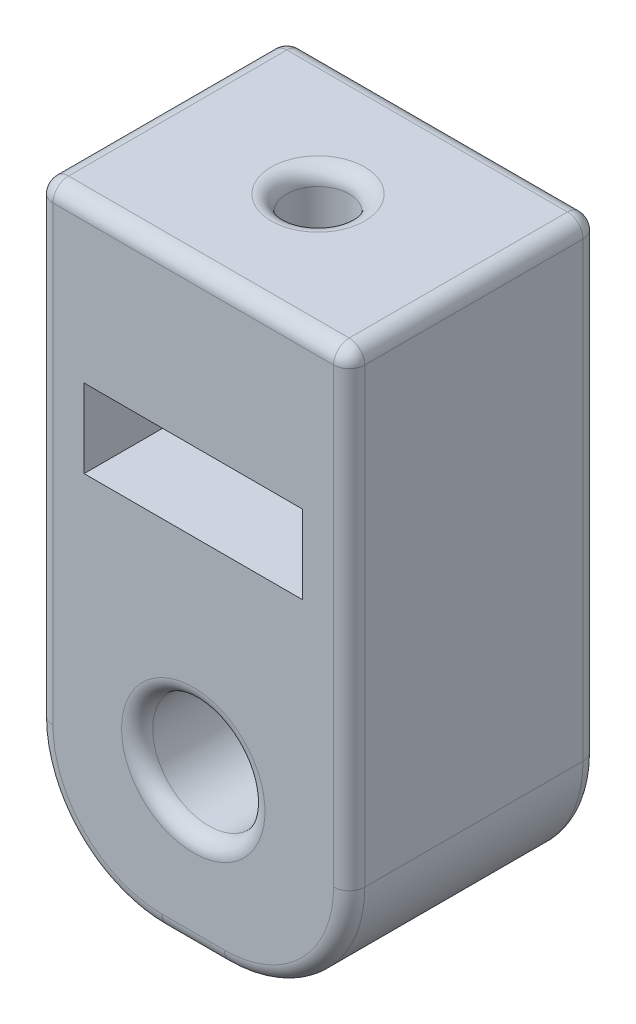
from build123d import *

# Parameters (mm, degrees)
SKETCH1_W           = 12.7
SKETCH1_H           = 24.13
SKETCH1_R           = 2.286
BOSS_EXTRUDE1_DEPTH = 10.16
SKETCH2_R           = 1.27
CUT_EXTRUDE1_DEPTH  = 15.24
FILLET2_R           = 5.08
FILLET1_R           = 0.635
SKETCH3_W           = 8.89
SKETCH3_H           = 3.19532
CUT_EXTRUDE2_DEPTH  = 30.099355663


with BuildPart() as part:
    # Sketch1 → Boss-Extrude1 (new body)
    with BuildSketch(Plane.XY):
        with Locations((6.35, 12.065)):
            Rectangle(SKETCH1_W, SKETCH1_H)
        with Locations((6.35, 6.35)):
            Circle(SKETCH1_R, mode=Mode.SUBTRACT)
    extrude(amount=BOSS_EXTRUDE1_DEPTH)

    # Sketch2 → Cut-Extrude1 (cut)
    with BuildSketch(Plane(origin=(0, 24.13, 0), x_dir=(1, 0, 0), z_dir=(0, 1, 0))):
        with Locations(Location((6.35, -5.08, 0), (0, 0, 270))):
            Circle(SKETCH2_R)
    extrude(amount=-CUT_EXTRUDE1_DEPTH, mode=Mode.SUBTRACT)

    # Fillet2
    fillet2_edges = [part.edges().sort_by_distance(p)[0] for p in [
        (12.7, 0, 5.08),
        (0, 0, 5.08),
    ]]
    fillet(fillet2_edges, radius=FILLET2_R)

    # Fillet1
    fillet1_edges = [part.edges().sort_by_distance(p)[0] for p in [
        (4.064, 6.35, 0),
        (4.064, 6.35, 10.16),
        (6.35, 24.13, 10.16),
        (6.35, 24.13, 3.81),
        (12.7, 14.605, 0),
        (12.7, 14.605, 10.16),
        (6.35, 0, 0),
        (1.487897552, 1.487897552, 0),
        (11.212102448, 1.487897552, 0),
        (6.35, 0, 10.16),
        (1.487897552, 1.487897552, 10.16),
        (11.212102448, 1.487897552, 10.16),
        (0, 14.605, 10.16),
        (6.35, 24.13, 0),
        (0, 14.605, 0),
        (0, 24.13, 5.08),
        (12.7, 24.13, 5.08),
    ]]
    fillet(fillet1_edges, radius=FILLET1_R)

    # Sketch3 → Cut-Extrude2 (cut, through all)
    with BuildSketch(Plane(origin=(0, 0, 0), x_dir=(-1, 0, 0), z_dir=(0, 0, -1))):
        with Locations((-6.35, 16.18234)):
            Rectangle(SKETCH3_W, SKETCH3_H)
    extrude(amount=-CUT_EXTRUDE2_DEPTH, mode=Mode.SUBTRACT)


solid = part.part
